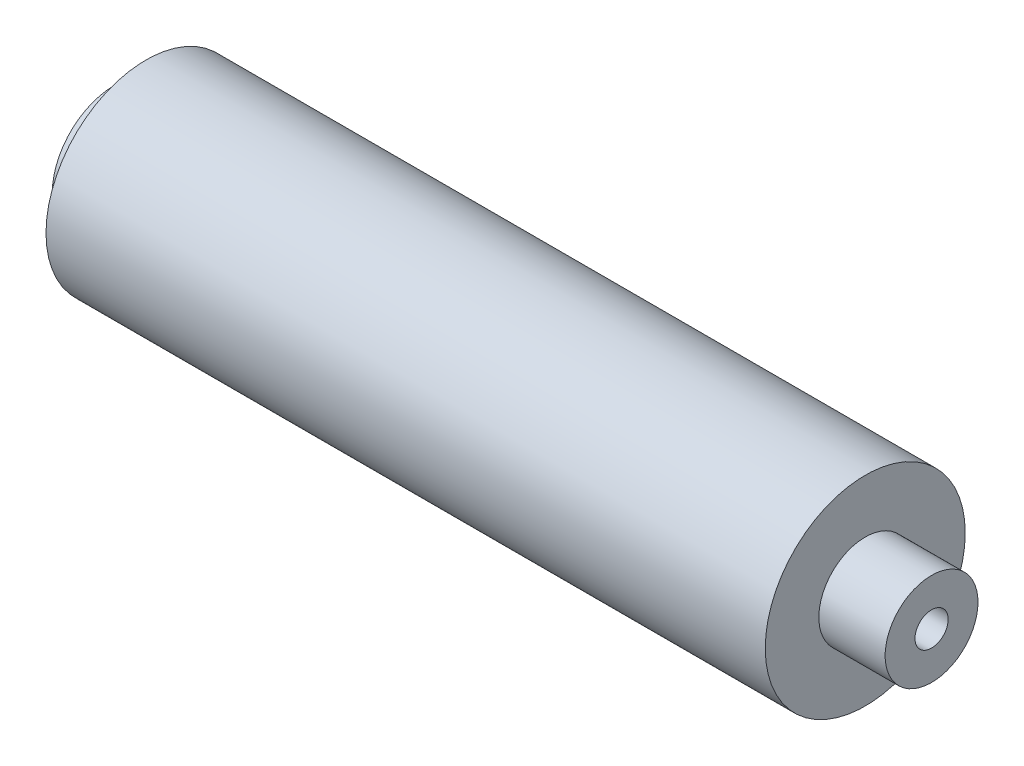
from build123d import *
from build123d.topology import SkipClean

# Parameters (mm, degrees)
SKETCH1_R           = 15.07617
BOSS_EXTRUDE1_DEPTH = 118.4446395
SKETCH2_R           = 9.3853
SKETCH2_R_2         = 4.5847
BOSS_EXTRUDE2_DEPTH = 4.7498
CUT_EXTRUDE1_DEPTH  = 26
SKETCH4_R           = 2.5
CUT_EXTRUDE2_DEPTH  = 2.6
CUT_EXTRUDE3_START  = -10
SKETCH5_R           = 15.07617
SKETCH5_R_2         = 7
CUT_EXTRUDE3_DEPTH  = 10


with BuildPart() as part:
    # Sketch1 → Boss-Extrude1 (new body)
    with BuildSketch(Plane(origin=(0, 0, 0), x_dir=(0, 0, -1), z_dir=(1, 0, 0))):
        with Locations(Location((0, 0, 0), (0, 0, 180))):
            Circle(SKETCH1_R)
    extrude(amount=BOSS_EXTRUDE1_DEPTH)

    # Sketch2 → Boss-Extrude2 (add)
    with BuildSketch(Plane.ZY):
        with Locations(Location((0, 0, 0), (0, 0, 180))):
            Circle(SKETCH2_R)
        Circle(SKETCH2_R_2, mode=Mode.SUBTRACT)
    extrude(amount=BOSS_EXTRUDE2_DEPTH)

    # Sketch3 → Cut-Extrude1 (cut)
    with BuildSketch(Plane(origin=(118.4446395, 0, 0), x_dir=(0, 0, -1), z_dir=(1, 0, 0))):
        with BuildLine():
            Line((-1.7853571, 1.750000007), (1.7853571, 1.750000007))
            ThreePointArc((1.7853571, 1.750000007), (0, -2.5), (-1.7853571, 1.750000007))
        make_face()
    extrude(amount=-CUT_EXTRUDE1_DEPTH, mode=Mode.SUBTRACT)

    # Sketch4 → Cut-Extrude2 (cut)
    with SkipClean():  # the faces are left unmerged after this step: merging them gives an invalid solid
        with BuildSketch(Plane(origin=(118.4446395, 0, 0), x_dir=(0, 0, -1), z_dir=(1, 0, 0))):
            Circle(SKETCH4_R)
        extrude(amount=-CUT_EXTRUDE2_DEPTH, mode=Mode.SUBTRACT)

    # Sketch5 → Cut-Extrude3 (cut)
    with SkipClean():  # the faces are left unmerged after this step: merging them gives an invalid solid
        with BuildSketch(Plane(origin=(118.4446395, 0, 0), x_dir=(0, 0, -1), z_dir=(1, 0, 0)).offset(CUT_EXTRUDE3_START)):
            with Locations(Location((0, 0, 0), (0, 0, 180))):
                Circle(SKETCH5_R)
            Circle(SKETCH5_R_2, mode=Mode.SUBTRACT)
        extrude(amount=CUT_EXTRUDE3_DEPTH, mode=Mode.SUBTRACT)


solid = part.part
